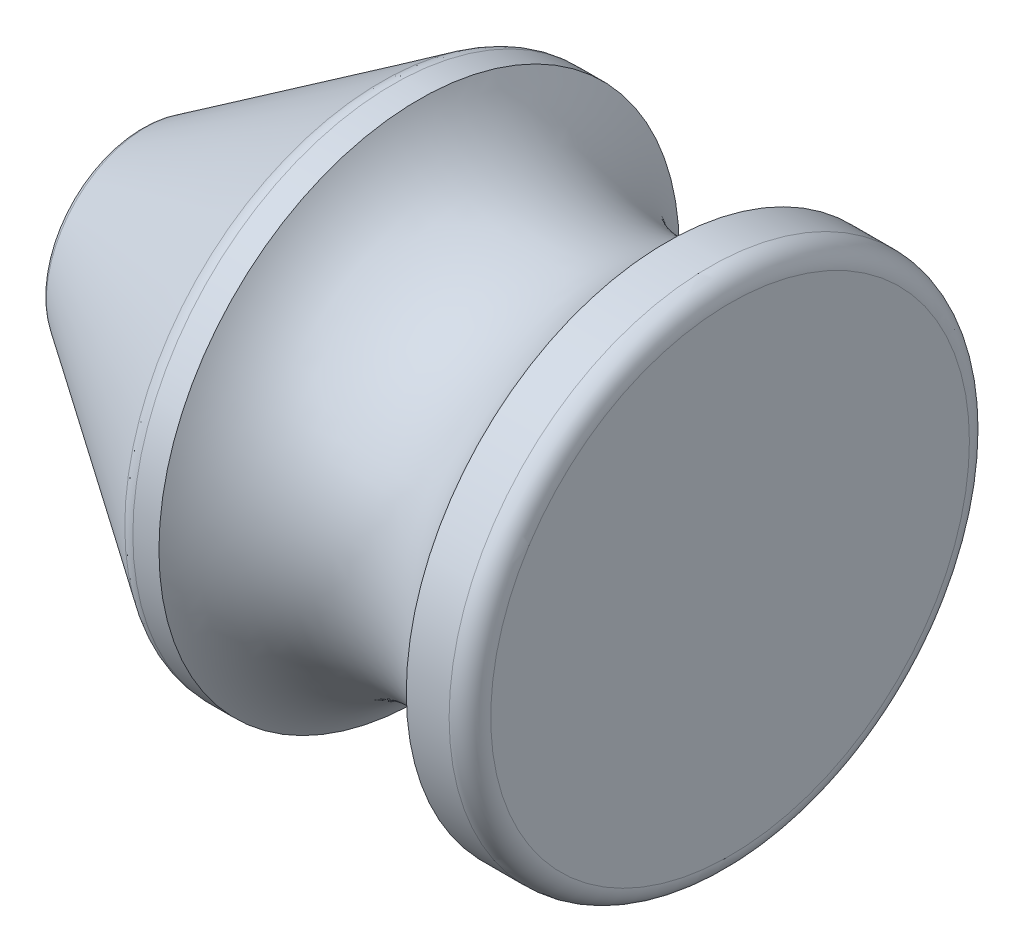
from build123d import *

# Parameters (mm, degrees)
SALIENTE_EXTRUIR1_DEPTH      = 9
SALIENTE_EXTRUIR1_DEPTH_BACK = 19.5
CROQUIS1_R                   = 12.5
CROQUIS2_R                   = 7
CHAFL_N1_SIZE                = 8
CHAFL_N1_SIZE2               = 12
REDONDEO1_R                  = 1
REDONDEO2_R                  = 1
SALIENTE_EXTRUIR2_START      = -3
SALIENTE_EXTRUIR2_DEPTH      = 12


with BuildPart() as part:
    # Croquis1 → Saliente-Extruir1 (new, two sides: drawn at the far end of the back side and taken through both)
    with BuildSketch(Plane.YZ.offset(-SALIENTE_EXTRUIR1_DEPTH_BACK)):
        with Locations(Location((0, 0, 0), (0, 0, 270))):
            Circle(CROQUIS1_R)
        with BuildLine():
            Line((-1.897366596, 1.3), (1.897366596, 1.3))
            ThreePointArc((1.897366596, 1.3), (0, -2.3), (-1.897366596, 1.3))
        make_face(mode=Mode.SUBTRACT)
    extrude(amount=SALIENTE_EXTRUIR1_DEPTH + SALIENTE_EXTRUIR1_DEPTH_BACK)

    # Croquis2 → Cortar-Revolución1 (revolve, cut)
    with BuildSketch(Plane(origin=(0, 0, 0), x_dir=(-1, 0, 0), z_dir=(0, 1, 0)), mode=Mode.PRIVATE) as cortar_revoluci_n1_sk:
        with Locations((0, 16.2)):
            Circle(CROQUIS2_R)
    revolve(cortar_revoluci_n1_sk.sketch.rotate(Axis((7.517678172, 0, 0), (-1, 0, 0)), 180), axis=Axis((7.517678172, 0, 0), (-1, 0, 0)), mode=Mode.SUBTRACT)

    # Chaflán1
    chafl_n1_edges = [part.edges().sort_by_distance(p)[0] for p in [
        (-19.5, 0, 12.5),
    ]]
    chafl_n1_side = [part.faces().sort_by_distance(p)[0] for p in [
        (-19.5, 0, 12.146446609),
    ]]
    chamfer(chafl_n1_edges, length=CHAFL_N1_SIZE, length2=CHAFL_N1_SIZE2, reference=chafl_n1_side[0])

    # Redondeo1
    redondeo1_edges = [part.edges().sort_by_distance(p)[0] for p in [
        (-7.5, 0, 12.5),
        (-19.5, 0, 4.5),
    ]]
    fillet(redondeo1_edges, radius=REDONDEO1_R)

    # Redondeo2
    redondeo2_edges = [part.edges().sort_by_distance(p)[0] for p in [
        (9, 0, 12.5),
    ]]
    fillet(redondeo2_edges, radius=REDONDEO2_R)

    # Croquis1<3> → Saliente-Extruir2 (add)
    with BuildSketch(Plane.YZ.offset(SALIENTE_EXTRUIR2_START)):
        with BuildLine():
            ThreePointArc((2.3, 0), (2.197037001, 0.680461913), (1.897366596, 1.3))
            Line((1.897366596, 1.3), (-1.897366596, 1.3))
            ThreePointArc((-1.897366596, 1.3), (-0.680461913, -2.197037001), (2.3, 0))
        make_face()
        with BuildLine():
            Line((-1.897366596, 1.3), (1.897366596, 1.3))
            ThreePointArc((1.897366596, 1.3), (0, 2.3), (-1.897366596, 1.3))
        make_face()
    extrude(amount=SALIENTE_EXTRUIR2_DEPTH)


solid = part.part
